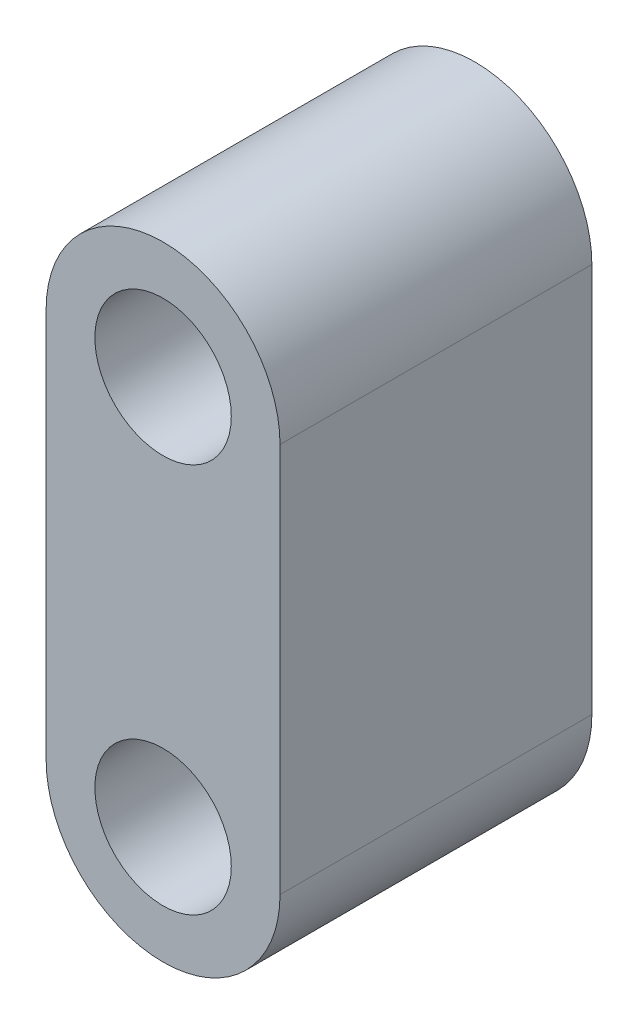
from build123d import *

# Parameters (mm, degrees)
BOSS_EXTRUDE1_DEPTH      = 8
SCHIZZO1_R               = 1.75
TAGLIO_ESTRUSIONE1_DEPTH = 8


with BuildPart() as part:
    # Sketch1 → Boss-Extrude1 (new body)
    with BuildSketch(Plane.XY):
        with BuildLine():
            Line((-3, 5), (-3, -5))
            ThreePointArc((-3, -5), (0, -8), (3, -5))
            Line((3, -5), (3, 5))
            ThreePointArc((3, 5), (0, 8), (-3, 5))
        make_face()
    extrude(amount=BOSS_EXTRUDE1_DEPTH)

    # Schizzo1 → Taglio-Estrusione1 (cut)
    with BuildSketch(Plane.XY.offset(8)):
        with Locations((0, 5)):
            Circle(SCHIZZO1_R)
    taglio_estrusione1 = extrude(amount=-TAGLIO_ESTRUSIONE1_DEPTH, mode=Mode.SUBTRACT)

    # Specchia1: Taglio-Estrusione1 across plane
    add(taglio_estrusione1.mirror(Plane.ZX), mode=Mode.SUBTRACT)


solid = part.part
